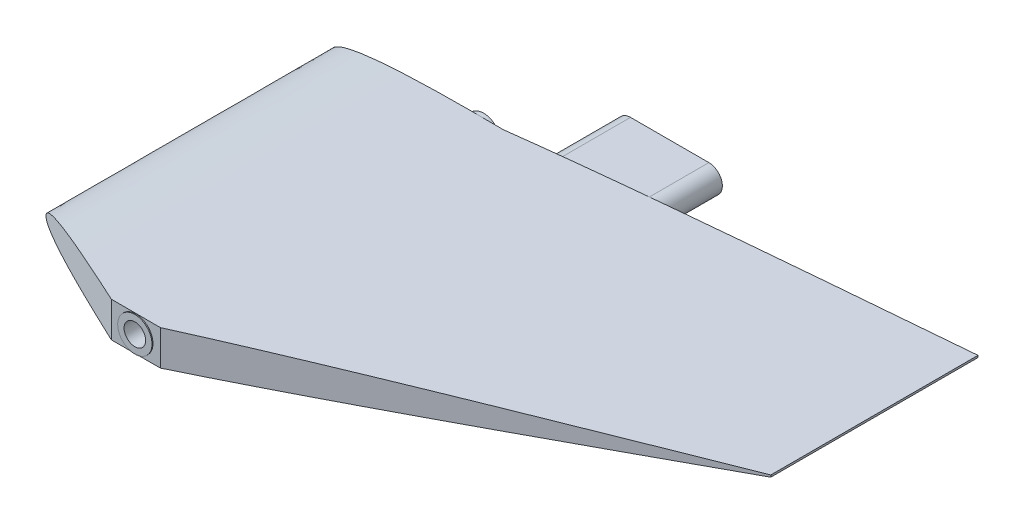
from build123d import *

# Parameters (mm, degrees)
BOSS_EXTRUDE1_DEPTH     = 50
CUT_EXTRUDE1_DEPTH      = 68.292354146
CUT_EXTRUDE1_DEPTH_BACK = 68.292354146
SKETCH3_R               = 1.75
BOSS_EXTRUDE2_DEPTH     = 0.1
BOSS_EXTRUDE3_START     = 0.5
SKETCH5_R               = 1.75
BOSS_EXTRUDE3_DEPTH     = 0.5
SKETCH4_R               = 1.1
CUT_EXTRUDE2_DEPTH      = 61.952851438
BOSS_EXTRUDE4_REACH     = 62.971
BOSS_EXTRUDE5_START     = 2
BOSS_EXTRUDE5_DEPTH     = 2
SKETCH8_R               = 0.625
CUT_EXTRUDE3_DEPTH      = 65.090580501


with BuildPart() as part:
    # Sketch1 → Boss-Extrude1 (new body)
    with BuildSketch(Plane.XY):
        with BuildLine():
            Line((-15, 0), (44.999916667, 0))
            Line((44.999916667, 0), (44.999916667, 0.1))
            add(Edge.make_bspline(
                [(-15, 0), (-15, 3.230995927), (19.077066257, 1.403070244), (44.999916667, 0.1)],
                knots=[0, 0, 0, 0, 1, 1, 1, 1], degree=3))
        make_face()
    boss_extrude1 = extrude(amount=BOSS_EXTRUDE1_DEPTH)

    # Mirror1: Boss-Extrude1 across plane
    add(boss_extrude1.mirror(Plane(origin=(-15, 0, 50), x_dir=(0, 0, 1), z_dir=(0, 1, 0))))

    # Sketch2 → Cut-Extrude1 (cut, two sides: drawn at the far end of the back side and taken through both)
    with BuildSketch(Plane(origin=(0, 0, 0), x_dir=(1, 0, 0), z_dir=(0, 1, 0)).offset(-CUT_EXTRUDE1_DEPTH_BACK)):
        Polygon((-26.522782457, -38.79799257), (-2.5, -50), (2.5, -50), (51.792235583, -27.01465306), (51.792235583, -55.115877471), (-26.522782457, -55.115877471), align=None)
        Polygon((-2.5, -15), (2.5, -15), (50.354863493, -8.27443754), (50.354863493, 7.033487097), (-23.694710504, 7.033487097), (-23.694710504, -15), align=None)
    extrude(amount=CUT_EXTRUDE1_DEPTH + CUT_EXTRUDE1_DEPTH_BACK, mode=Mode.SUBTRACT)

    # Sketch3 → Boss-Extrude2 (add)
    with BuildSketch(Plane.XY.offset(50)):
        Circle(SKETCH3_R)
    extrude(amount=BOSS_EXTRUDE2_DEPTH)

    # Sketch5 → Boss-Extrude3 (add)
    with BuildSketch(Plane(origin=(0, 0, 15), x_dir=(-1, 0, 0), z_dir=(0, 0, -1)).offset(BOSS_EXTRUDE3_START)):
        with Locations(Location((0, 0, 0), (0, 0, 180))):
            Circle(SKETCH5_R)
    extrude(amount=-BOSS_EXTRUDE3_DEPTH)

    # Sketch4 → Cut-Extrude2 (cut, through all)
    with BuildSketch(Plane.XY.offset(50.1)):
        Circle(SKETCH4_R)
    extrude(amount=-CUT_EXTRUDE2_DEPTH, mode=Mode.SUBTRACT)

    # Boss-Extrude4: up to this plane
    boss_extrude4_end = Plane(origin=(50.354863493, -1.966265525, 8.27443754), z_dir=(0.1391731009600588, 0, 0.9902680687415713))
    # Sketch6 → Boss-Extrude4 (add, up to the surface)
    with BuildSketch(Plane(origin=(0, 0, 9), x_dir=(-1, 0, 0), z_dir=(0, 0, -1)), mode=Mode.PRIVATE) as boss_extrude4_sk1:
        with BuildLine():
            Line((-7.5, -1.375), (-15.5, -1.375))
            ThreePointArc((-15.5, -1.375), (-16.875, 0), (-15.5, 1.375))
            Line((-15.5, 1.375), (-7.5, 1.375))
            ThreePointArc((-7.5, 1.375), (-6.125, 0), (-7.5, -1.375))
        make_face()
    boss_extrude4_tool1 = split(extrude(boss_extrude4_sk1.sketch, amount=-BOSS_EXTRUDE4_REACH, mode=Mode.PRIVATE), bisect_by=boss_extrude4_end, keep=Keep.BOTH, mode=Mode.PRIVATE)
    add(boss_extrude4_tool1.solids().sort_by_distance((11.5, 0, 9))[0])

    # Sketch7 → Boss-Extrude5 (add)
    with BuildSketch(Plane(origin=(0, 0, 9), x_dir=(-1, 0, 0), z_dir=(0, 0, -1)).offset(BOSS_EXTRUDE5_START)):
        with BuildLine():
            Line((-16.428971814, -1.01372401), (-2.026847595, -14.211761476))
            ThreePointArc((-2.026847595, -14.211761476), (2.047859011, -14.19232148), (2.344581604, -10.128386498))
            Line((2.344581604, -10.128386498), (-6.425400098, 0.857822855))
            ThreePointArc((-6.425400098, 0.857822855), (-6.903712077, 1.238977689), (-7.5, 1.375))
            Line((-7.5, 1.375), (-15.5, 1.375))
            ThreePointArc((-15.5, 1.375), (-16.781502149, 0.498374601), (-16.428971814, -1.01372401))
        make_face()
    extrude(amount=-BOSS_EXTRUDE5_DEPTH)

    # Sketch8 → Cut-Extrude3 (cut, through all)
    with BuildSketch(Plane(origin=(0, 0, 7), x_dir=(-1, 0, 0), z_dir=(0, 0, -1))):
        with Locations((0, -12)):
            Circle(SKETCH8_R)
    extrude(amount=-CUT_EXTRUDE3_DEPTH, mode=Mode.SUBTRACT)


solid = part.part
